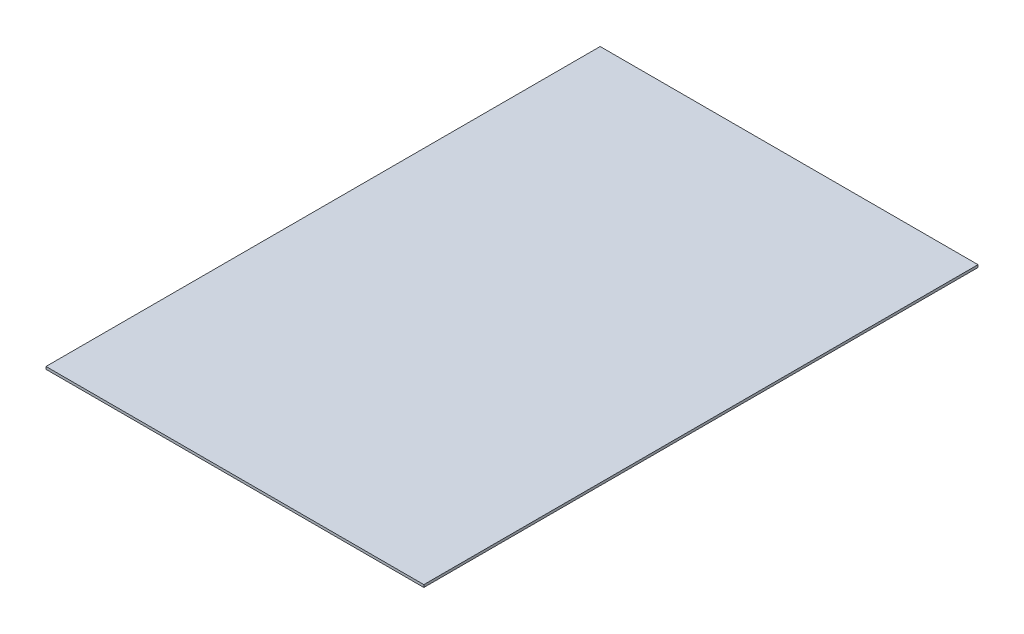
from build123d import *

# Parameters (mm, degrees)
SKETCH1_W           = 7500
SKETCH1_H           = 11000
BOSS_EXTRUDE1_DEPTH = 50
SKETCH2_W           = 750
SKETCH2_H           = 750
SKETCH2_W_2         = 500
SKETCH2_H_2         = 500
CUT_EXTRUDE1_DEPTH  = 10


with BuildPart() as part:
    # Sketch1 → Boss-Extrude1 (new body)
    with BuildSketch(Plane(origin=(0, 0, 0), x_dir=(1, 0, 0), z_dir=(0, 1, 0))):
        Rectangle(SKETCH1_W, SKETCH1_H)
    extrude(amount=BOSS_EXTRUDE1_DEPTH)

    # Sketch2 → Cut-Extrude1 (cut)
    with BuildSketch(Plane.XZ):
        with Locations((1875, 3000)):
            Rectangle(SKETCH2_W, SKETCH2_H)
        with Locations((-1875, 3000)):
            Rectangle(SKETCH2_W, SKETCH2_H)
        with Locations((-1875, -3000)):
            Rectangle(SKETCH2_W, SKETCH2_H)
        with Locations((1875, -3000)):
            Rectangle(SKETCH2_W, SKETCH2_H)
        with Locations((0, 1250)):
            Rectangle(SKETCH2_W_2, SKETCH2_H_2)
    extrude(amount=-CUT_EXTRUDE1_DEPTH, mode=Mode.SUBTRACT)


solid = part.part
